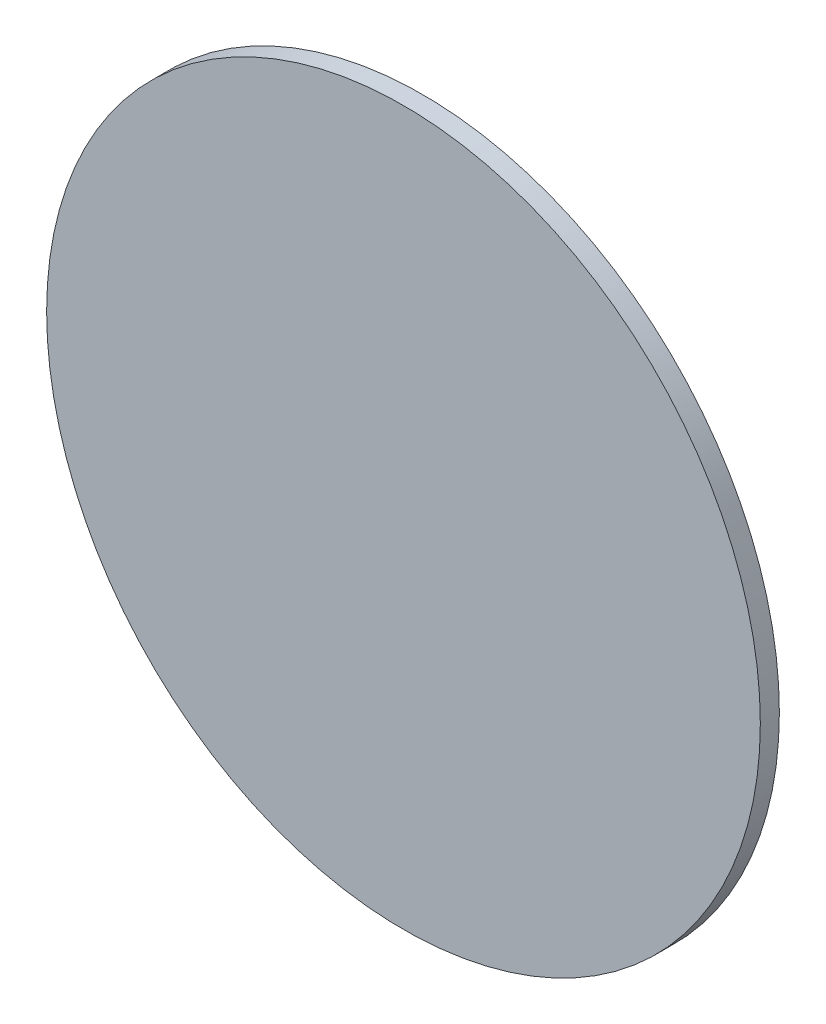
from build123d import *

# Parameters (mm, degrees)
CROQUIS1_R              = 22.5
SALIENTE_EXTRUIR1_DEPTH = 1.2


with BuildPart() as part:
    # Croquis1 → Saliente-Extruir1 (new body)
    with BuildSketch(Plane.XY):
        with Locations((-34.828769799, 5.499279442)):
            Circle(CROQUIS1_R)
    extrude(amount=SALIENTE_EXTRUIR1_DEPTH)


solid = part.part
